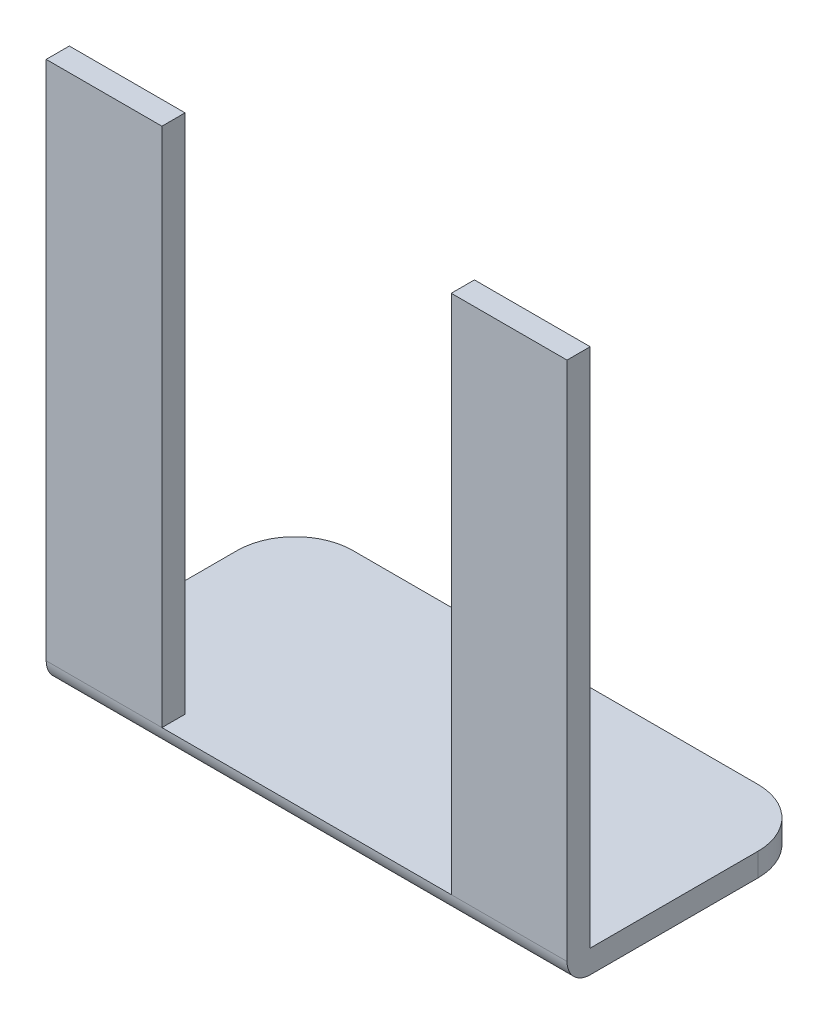
from build123d import *

# Parameters (mm, degrees)
SKETCH1_W           = 45
SKETCH1_H           = 47
BOSS_EXTRUDE1_DEPTH = 2
SKETCH2_W           = 45
SKETCH2_H           = 2
BOSS_EXTRUDE2_DEPTH = 19.5
FILLET1_R           = 2
FILLET2_R           = 5
SKETCH3_W           = 25
SKETCH3_H           = 22.5
CUT_EXTRUDE1_DEPTH  = 39.99679474
SKETCH4_R           = 1.5
CUT_EXTRUDE2_DEPTH  = 54.958317246
SKETCH5_W           = 25
SKETCH5_H           = 22.5
CUT_EXTRUDE3_DEPTH  = 10


with BuildPart() as part:
    # Sketch1 → Boss-Extrude1 (new body)
    with BuildSketch(Plane.XY):
        Rectangle(SKETCH1_W, SKETCH1_H)
    extrude(amount=BOSS_EXTRUDE1_DEPTH)

    # Sketch2 → Boss-Extrude2 (add)
    with BuildSketch(Plane(origin=(0, 0, 0), x_dir=(-1, 0, 0), z_dir=(0, 0, -1))):
        with Locations((0, -22.5)):
            Rectangle(SKETCH2_W, SKETCH2_H)
    extrude(amount=BOSS_EXTRUDE2_DEPTH)

    # Fillet1
    fillet1_edges = [part.edges().sort_by_distance(p)[0] for p in [
        (0, -23.5, 2),
    ]]
    fillet(fillet1_edges, radius=FILLET1_R)

    # Fillet2
    fillet2_edges = [part.edges().sort_by_distance(p)[0] for p in [
        (22.5, -22.5, -19.5),
        (-22.5, -22.5, -19.5),
    ]]
    fillet(fillet2_edges, radius=FILLET2_R)

    # Sketch3 → Cut-Extrude1 (cut, through all)
    with BuildSketch(Plane.XY.offset(2)):
        with Locations((0, 12.25)):
            Rectangle(SKETCH3_W, SKETCH3_H)
    extrude(amount=-CUT_EXTRUDE1_DEPTH, mode=Mode.SUBTRACT)

    # Sketch4 → Cut-Extrude2 (cut, through all)
    with BuildSketch(Plane(origin=(0, -21.5, 0), x_dir=(1, 0, 0), z_dir=(0, 1, 0))):
        with Locations(Location((0, 14.5, 0), (0, 0, 180))):
            Circle(SKETCH4_R)
    extrude(amount=-CUT_EXTRUDE2_DEPTH, mode=Mode.SUBTRACT)

    # Sketch5 → Cut-Extrude3 (cut)
    with BuildSketch(Plane(origin=(0, 0, 0), x_dir=(-1, 0, 0), z_dir=(0, 0, -1))):
        with Locations((0, -10.25)):
            Rectangle(SKETCH5_W, SKETCH5_H)
    extrude(amount=-CUT_EXTRUDE3_DEPTH, mode=Mode.SUBTRACT)


solid = part.part
